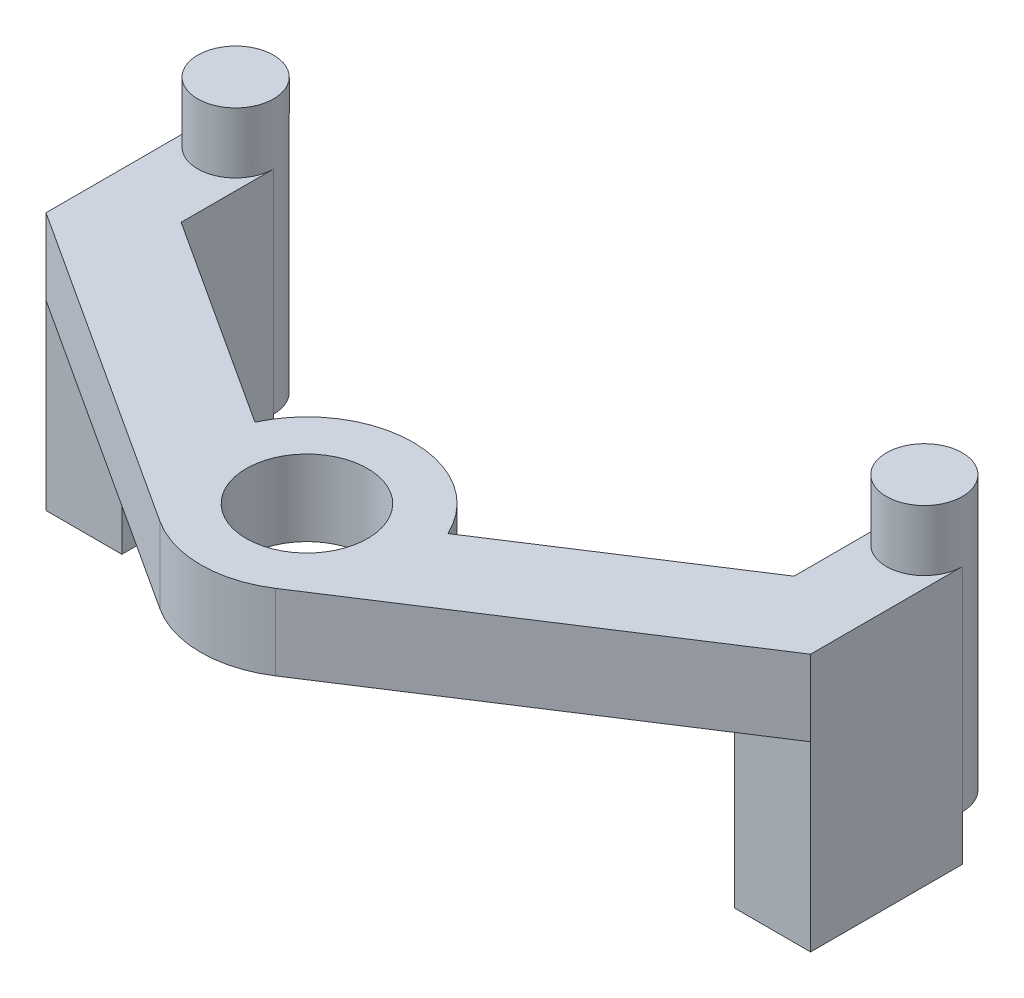
from build123d import *

# Parameters (mm, degrees)
ESBO_O1_R                = 2
RESSALTO_EXTRUS_O1_DEPTH = 2.5
RESSALTO_EXTRUS_O2_DEPTH = 7
RESSALTO_EXTRUS_O3_START = 2
ESBO_O1_4_R              = 1.25
RESSALTO_EXTRUS_O3_DEPTH = 2
ESBO_O2_W                = 2.5
ESBO_O2_H                = 5
RESSALTO_EXTRUS_O4_DEPTH = 1.5


with BuildPart() as part:
    # Esboço1 → Ressalto-extrusão1 (new body)
    with BuildSketch(Plane(origin=(0, 0, 0), x_dir=(1, 0, 0), z_dir=(0, 1, 0))):
        with BuildLine():
            ThreePointArc((-10.1, 9), (-11.35, 10.25), (-12.6, 9))
            Line((-12.6, 9), (-12.6, 4))
            Line((-12.6, 4), (-1.904447094, -2.936508346))
            ThreePointArc((-1.904447094, -2.936508346), (0, -3.5), (1.904447094, -2.936508346))
            Line((1.904447094, -2.936508346), (12.6, 4))
            Line((12.6, 4), (12.6, 9))
            ThreePointArc((12.6, 9), (11.35, 10.25), (10.1, 9))
            Line((10.1, 9), (10.1, 5.954321796))
            Line((10.1, 5.954321796), (3.178453386, 1.465412595))
            ThreePointArc((3.178453386, 1.465412595), (0, 3.5), (-3.178453386, 1.465412595))
            Line((-3.178453386, 1.465412595), (-10.1, 5.954321796))
            Line((-10.1, 5.954321796), (-10.1, 9))
        make_face()
        Circle(ESBO_O1_R, mode=Mode.SUBTRACT)
    extrude(amount=-RESSALTO_EXTRUS_O1_DEPTH)

    # Esboço1<3> → Ressalto-extrusão2 (add)
    with BuildSketch(Plane(origin=(0, 0, 0), x_dir=(1, 0, 0), z_dir=(0, 1, 0))):
        with BuildLine():
            ThreePointArc((-10.1, 9), (-11.35, 10.25), (-12.6, 9))
            Line((-12.6, 9), (-12.6, 4))
            Line((-12.6, 4), (-10.1, 4))
            Line((-10.1, 4), (-10.1, 9))
        make_face()
        with BuildLine():
            Line((10.1, 9), (10.1, 4))
            Line((10.1, 4), (12.6, 4))
            Line((12.6, 4), (12.6, 9))
            ThreePointArc((12.6, 9), (11.35, 10.25), (10.1, 9))
        make_face()
    extrude(amount=-RESSALTO_EXTRUS_O2_DEPTH)

    # Esboço1<4> → Ressalto-extrusão3 (add)
    with BuildSketch(Plane(origin=(0, 0, 0), x_dir=(1, 0, 0), z_dir=(0, 1, 0)).offset(RESSALTO_EXTRUS_O3_START)):
        with Locations((-11.35, 9)):
            Circle(ESBO_O1_4_R)
        with Locations((11.35, 9)):
            Circle(ESBO_O1_4_R)
    extrude(amount=-RESSALTO_EXTRUS_O3_DEPTH)

    # Esboço2 → Ressalto-extrusão4 (add)
    with BuildSketch(Plane.XZ.offset(7)):
        with Locations((-11.35, -6.5)):
            Rectangle(ESBO_O2_W, ESBO_O2_H)
        with Locations((11.35, -6.5)):
            Rectangle(ESBO_O2_W, ESBO_O2_H)
    extrude(amount=RESSALTO_EXTRUS_O4_DEPTH)


solid = part.part
